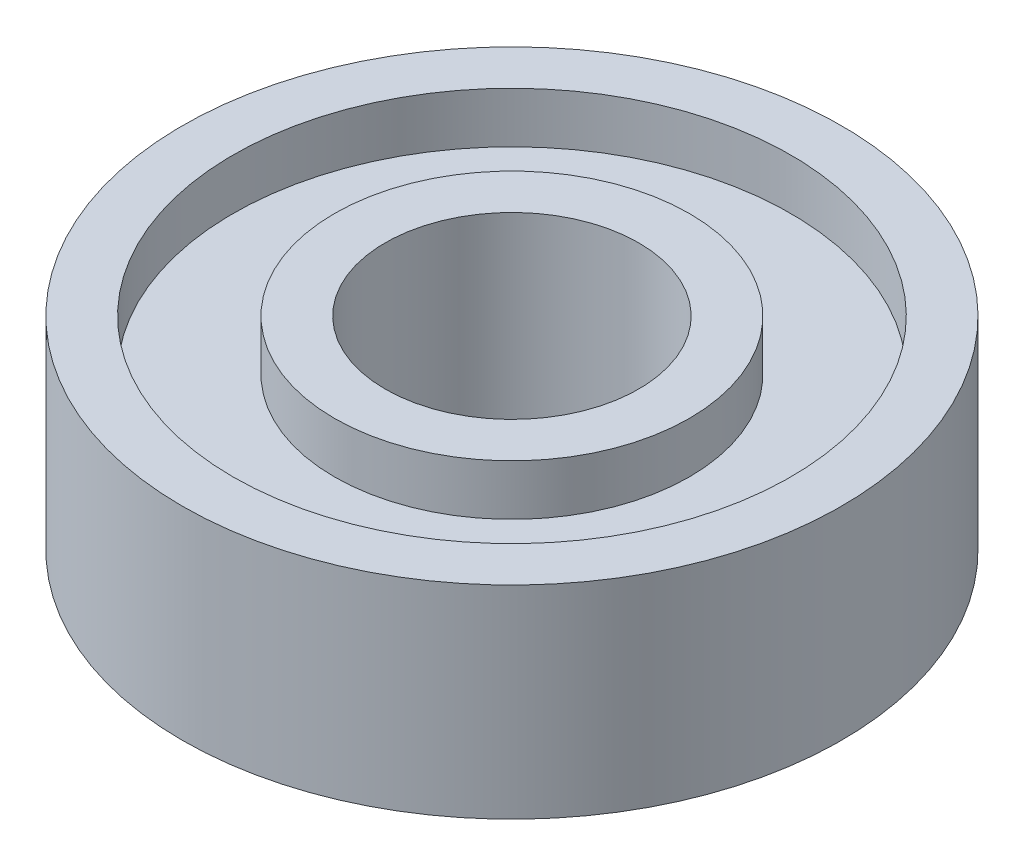
from build123d import *

# Parameters (mm, degrees)
SKETCH1_R           = 6.5
SKETCH1_R_2         = 2.5
BOSS_EXTRUDE1_DEPTH = 4
SKETCH2_R           = 5.5
SKETCH2_R_2         = 3.5
CUT_EXTRUDE1_DEPTH  = 1
CUT_EXTRUDE2_START  = -1
SKETCH3_R           = 5.5
SKETCH3_R_2         = 3.5
CUT_EXTRUDE2_DEPTH  = 1


with BuildPart() as part:
    # Sketch1 → Boss-Extrude1 (new body)
    with BuildSketch(Plane(origin=(0, 0, 0), x_dir=(1, 0, 0), z_dir=(0, 1, 0))):
        with Locations(Location((0, 0, 0), (0, 0, 270))):
            Circle(SKETCH1_R)
        with Locations(Location((0, 0, 0), (0, 0, 270))):
            Circle(SKETCH1_R_2, mode=Mode.SUBTRACT)
    extrude(amount=BOSS_EXTRUDE1_DEPTH)

    # Sketch2 → Cut-Extrude1 (cut)
    with BuildSketch(Plane(origin=(0, 4, 0), x_dir=(1, 0, 0), z_dir=(0, 1, 0))):
        with Locations(Location((0, 0, 0), (0, 0, 270))):
            Circle(SKETCH2_R)
        with Locations(Location((0, 0, 0), (0, 0, 270))):
            Circle(SKETCH2_R_2, mode=Mode.SUBTRACT)
    extrude(amount=-CUT_EXTRUDE1_DEPTH, mode=Mode.SUBTRACT)

    # Sketch3 → Cut-Extrude2 (cut)
    with BuildSketch(Plane.XZ.offset(CUT_EXTRUDE2_START)):
        with Locations(Location((0, 0, 0), (0, 0, 90))):
            Circle(SKETCH3_R)
        with Locations(Location((0, 0, 0), (0, 0, 90))):
            Circle(SKETCH3_R_2, mode=Mode.SUBTRACT)
    extrude(amount=CUT_EXTRUDE2_DEPTH, mode=Mode.SUBTRACT)


solid = part.part
